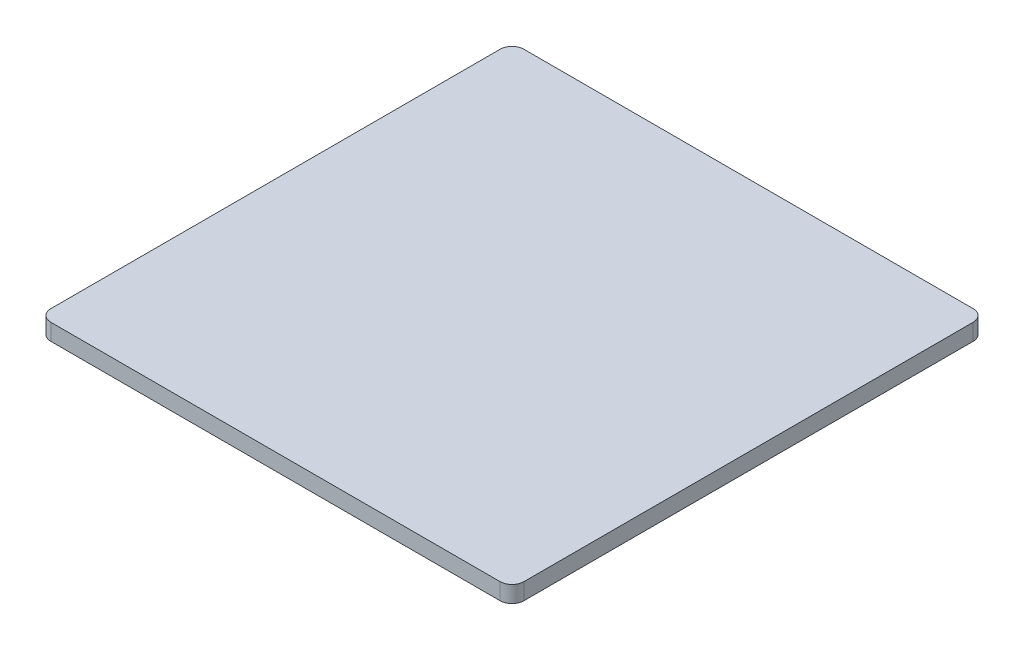
from build123d import *

# Parameters (mm, degrees)
BOSS_EXTRUDE1_DEPTH = 0.7


with BuildPart() as part:
    # Sketch1 → Boss-Extrude1 (new body)
    with BuildSketch(Plane(origin=(0, 0, 0), x_dir=(1, 0, 0), z_dir=(0, 1, 0))):
        with BuildLine():
            Line((10, -9.5), (10, 9.5))
            ThreePointArc((10, 9.5), (9.853553391, 9.853553391), (9.5, 10))
            Line((9.5, 10), (-9.5, 10))
            ThreePointArc((-9.5, 10), (-9.853553391, 9.853553391), (-10, 9.5))
            Line((-10, 9.5), (-10, -9.5))
            ThreePointArc((-10, -9.5), (-9.853553391, -9.853553391), (-9.5, -10))
            Line((-9.5, -10), (9.5, -10))
            ThreePointArc((9.5, -10), (9.853553391, -9.853553391), (10, -9.5))
        make_face()
    extrude(amount=BOSS_EXTRUDE1_DEPTH)


solid = part.part
